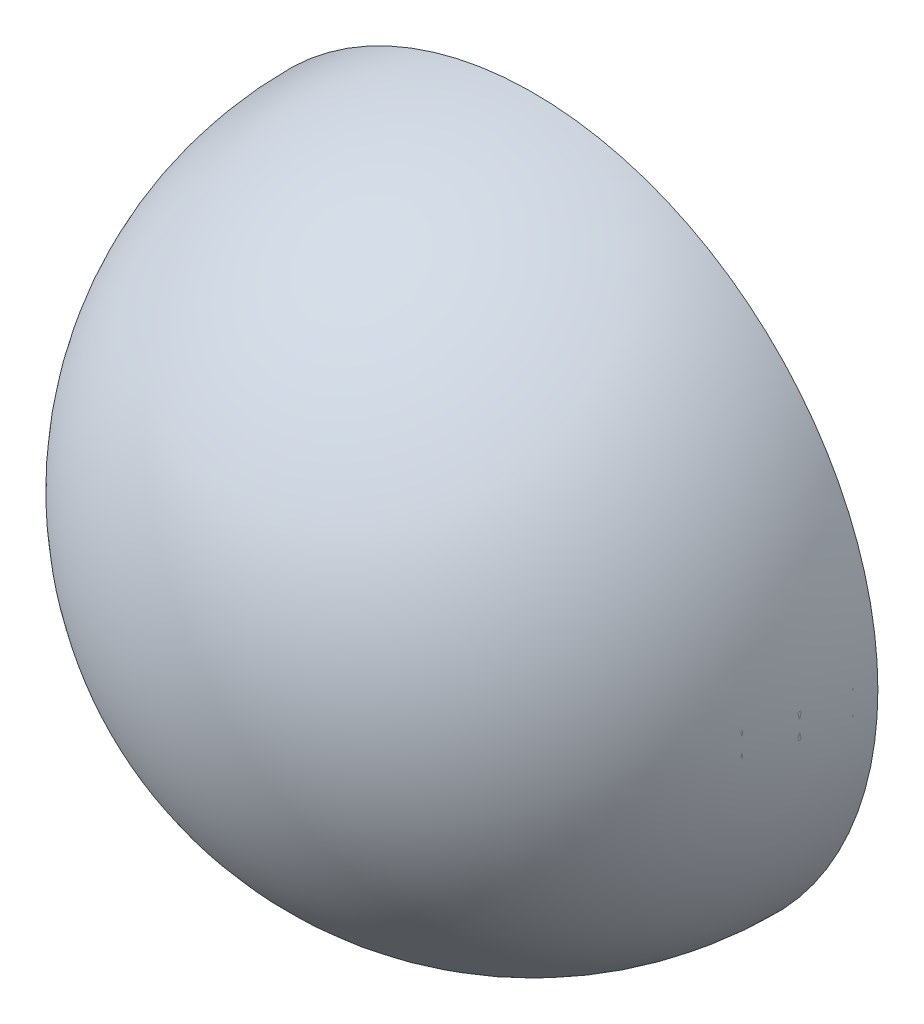
from build123d import *

# Parameters (mm, degrees)
REVOLVE1_ANGLE = 180
SHELL1_T       = -0.1


with BuildPart() as part:
    # Sketch1 → Revolve1 (revolve)
    with BuildSketch(Plane.XY):
        with BuildLine():
            Line((0, 150), (0, -150))
            ThreePointArc((0, -150), (150, 0), (0, 150))
        make_face()
    revolve(axis=Axis((0, -1000, 0), (0, -1, 0)), revolution_arc=REVOLVE1_ANGLE)

    # Shell1
    shell1_openings = [part.faces().sort_by_distance(p)[0] for p in [
        (0, 0, 0),
    ]]
    offset(amount=SHELL1_T, openings=shell1_openings)


solid = part.part
